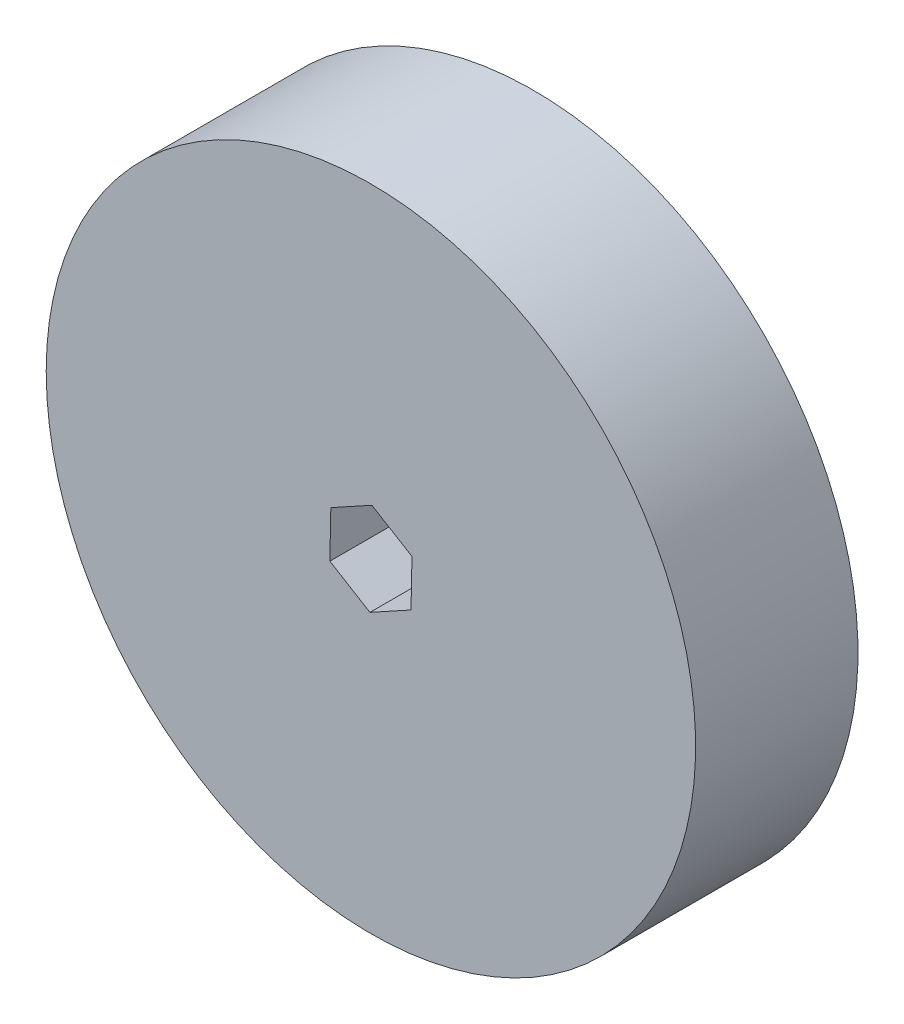
from build123d import *

# Parameters (mm, degrees)
SKETCH1_R           = 38.1
BOSS_EXTRUDE1_DEPTH = 19.05


with BuildPart() as part:
    # Sketch1 → Boss-Extrude1 (new body)
    with BuildSketch(Plane.XY):
        with Locations(Location((0, 0, 0), (0, 0, 180))):
            Circle(SKETCH1_R)
        Polygon((4.818540249, 2.650197137), (0.114132079, 5.498076834), (-4.70440817, 2.847879697), (-4.818540249, -2.650197137), (-0.114132079, -5.498076834), (4.70440817, -2.847879697), align=None, mode=Mode.SUBTRACT)
    extrude(amount=BOSS_EXTRUDE1_DEPTH)


solid = part.part
